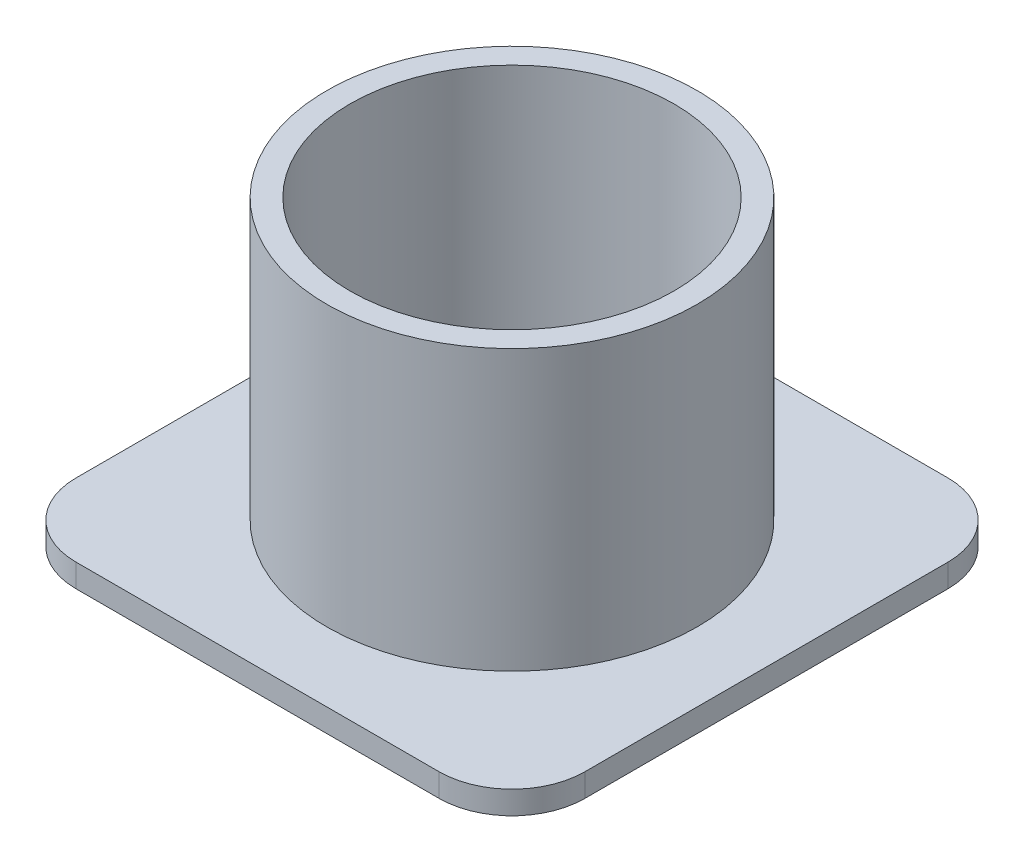
from build123d import *

# Parameters (mm, degrees)
BOSS_EXTRUDE1_DEPTH = 3.175
SKETCH2_R           = 22.245113978
CUT_EXTRUDE1_DEPTH  = 6.35
EXTRUDE_THIN1_START = 38.35
SKETCH2_2_R         = 25.420113978
SKETCH2_2_R_2       = 22.245113978
EXTRUDE_THIN1_DEPTH = 38.35


with BuildPart() as part:
    # Sketch1 → Boss-Extrude1 (new body)
    with BuildSketch(Plane(origin=(0, 0, 0), x_dir=(1, 0, 0), z_dir=(0, 1, 0))):
        with BuildLine():
            Line((-24.925, 34.925), (24.925, 34.925))
            ThreePointArc((24.925, 34.925), (31.996067812, 31.996067812), (34.925, 24.925))
            Line((34.925, 24.925), (34.925, -24.925))
            ThreePointArc((34.925, -24.925), (31.996067812, -31.996067812), (24.925, -34.925))
            Line((24.925, -34.925), (-24.925, -34.925))
            ThreePointArc((-24.925, -34.925), (-31.996067812, -31.996067812), (-34.925, -24.925))
            Line((-34.925, -24.925), (-34.925, 24.925))
            ThreePointArc((-34.925, 24.925), (-31.996067812, 31.996067812), (-24.925, 34.925))
        make_face()
    extrude(amount=BOSS_EXTRUDE1_DEPTH)

    # Sketch2 → Cut-Extrude1 (cut)
    with BuildSketch(Plane(origin=(0, 3.175, 0), x_dir=(1, 0, 0), z_dir=(0, 1, 0))):
        Circle(SKETCH2_R)
    extrude(amount=-CUT_EXTRUDE1_DEPTH, mode=Mode.SUBTRACT)

    # Sketch2<2> → Extrude-Thin1 (add)
    with BuildSketch(Plane(origin=(0, 3.175, 0), x_dir=(1, 0, 0), z_dir=(0, 1, 0)).offset(EXTRUDE_THIN1_START)):
        Circle(SKETCH2_2_R)
        Circle(SKETCH2_2_R_2, mode=Mode.SUBTRACT)
    extrude(amount=-EXTRUDE_THIN1_DEPTH)


solid = part.part
